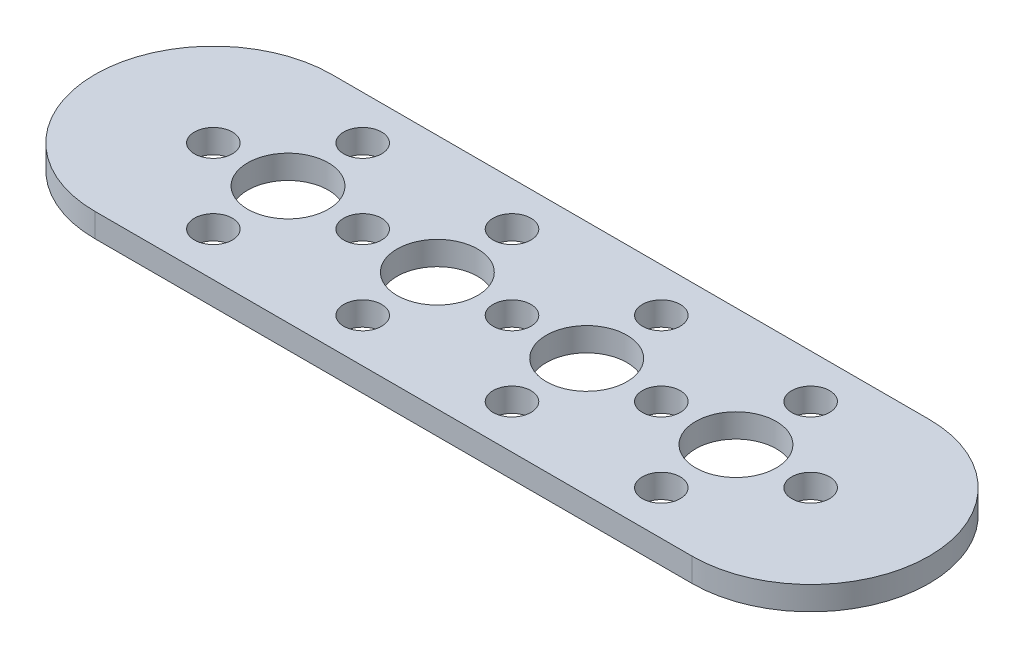
from build123d import *

# Parameters (mm, degrees)
SKETCH2_R           = 2.032
SKETCH2_R_2         = 4.318
BOSS_EXTRUDE1_DEPTH = 2.54


with BuildPart() as part:
    # Sketch2 → Boss-Extrude1 (new body)
    with BuildSketch(Plane(origin=(0, 0, 0), x_dir=(1, 0, 0), z_dir=(0, 1, 0))):
        with BuildLine():
            Line((56.007, 12.7), (-8.001, 12.7))
            ThreePointArc((-8.001, 12.7), (-20.701, 0), (-8.001, -12.7))
            Line((-8.001, -12.7), (56.007, -12.7))
            ThreePointArc((56.007, -12.7), (68.707, 0), (56.007, 12.7))
        make_face()
        with Locations((0, -8.001)):
            Circle(SKETCH2_R, mode=Mode.SUBTRACT)
        with Locations((16.002, -8.001)):
            Circle(SKETCH2_R, mode=Mode.SUBTRACT)
        with Locations((-8.001, 0)):
            Circle(SKETCH2_R, mode=Mode.SUBTRACT)
        with Locations((32.004, -8.001)):
            Circle(SKETCH2_R, mode=Mode.SUBTRACT)
        with Locations((48.006, -8.001)):
            Circle(SKETCH2_R, mode=Mode.SUBTRACT)
        with Locations((24.003, 0)):
            Circle(SKETCH2_R, mode=Mode.SUBTRACT)
        with Locations((40.005, 0)):
            Circle(SKETCH2_R, mode=Mode.SUBTRACT)
        with Locations((56.007, 0)):
            Circle(SKETCH2_R, mode=Mode.SUBTRACT)
        Circle(SKETCH2_R_2, mode=Mode.SUBTRACT)
        with Locations((8.001, 0)):
            Circle(SKETCH2_R, mode=Mode.SUBTRACT)
        with Locations((16.002, 0)):
            Circle(SKETCH2_R_2, mode=Mode.SUBTRACT)
        with Locations((0, 8.001)):
            Circle(SKETCH2_R, mode=Mode.SUBTRACT)
        with Locations((16.002, 8.001)):
            Circle(SKETCH2_R, mode=Mode.SUBTRACT)
        with Locations((32.004, 0)):
            Circle(SKETCH2_R_2, mode=Mode.SUBTRACT)
        with Locations((48.006, 0)):
            Circle(SKETCH2_R_2, mode=Mode.SUBTRACT)
        with Locations((32.004, 8.001)):
            Circle(SKETCH2_R, mode=Mode.SUBTRACT)
        with Locations((48.006, 8.001)):
            Circle(SKETCH2_R, mode=Mode.SUBTRACT)
    extrude(amount=BOSS_EXTRUDE1_DEPTH)


solid = part.part
